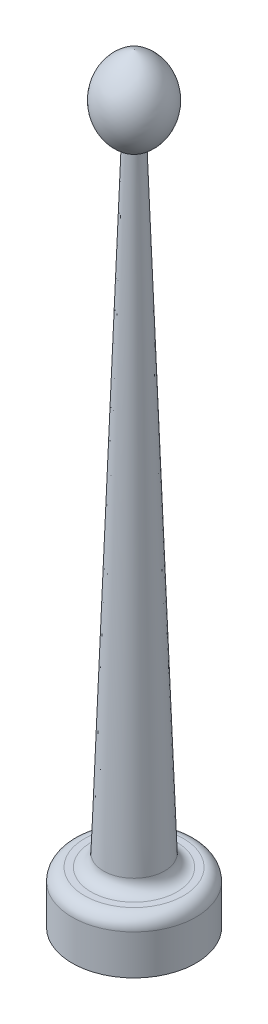
from build123d import *


with BuildPart() as part:
    # Croquis1 → Revolución1 (revolve)
    with BuildSketch(Plane.XY, mode=Mode.PRIVATE) as revoluci_n1_sk:
        with BuildLine():
            Line((0, 0), (2.5, 0))
            Line((2.5, 0), (2.5, 1.607955914))
            ThreePointArc((2.5, 1.607955914), (2.353553391, 1.961509305), (2, 2.107955914))
            Line((2, 2.107955914), (1.732844387, 2.107955914))
            ThreePointArc((1.732844387, 2.107955914), (1.385515202, 2.248286014), (1.233148974, 2.590506166))
            Line((1.233148974, 2.590506166), (0.370275271, 27.299976083))
            ThreePointArc((0.370275271, 27.299976083), (1.321868208, 29.121568104), (0, 30.695223418))
            Line((0, 30.695223418), (0, 0))
        make_face()
    revolve(revoluci_n1_sk.sketch.rotate(Axis((0, 0, 0), (0, 1, 0)), 90), axis=Axis((0, 0, 0), (0, 1, 0)))


solid = part.part
